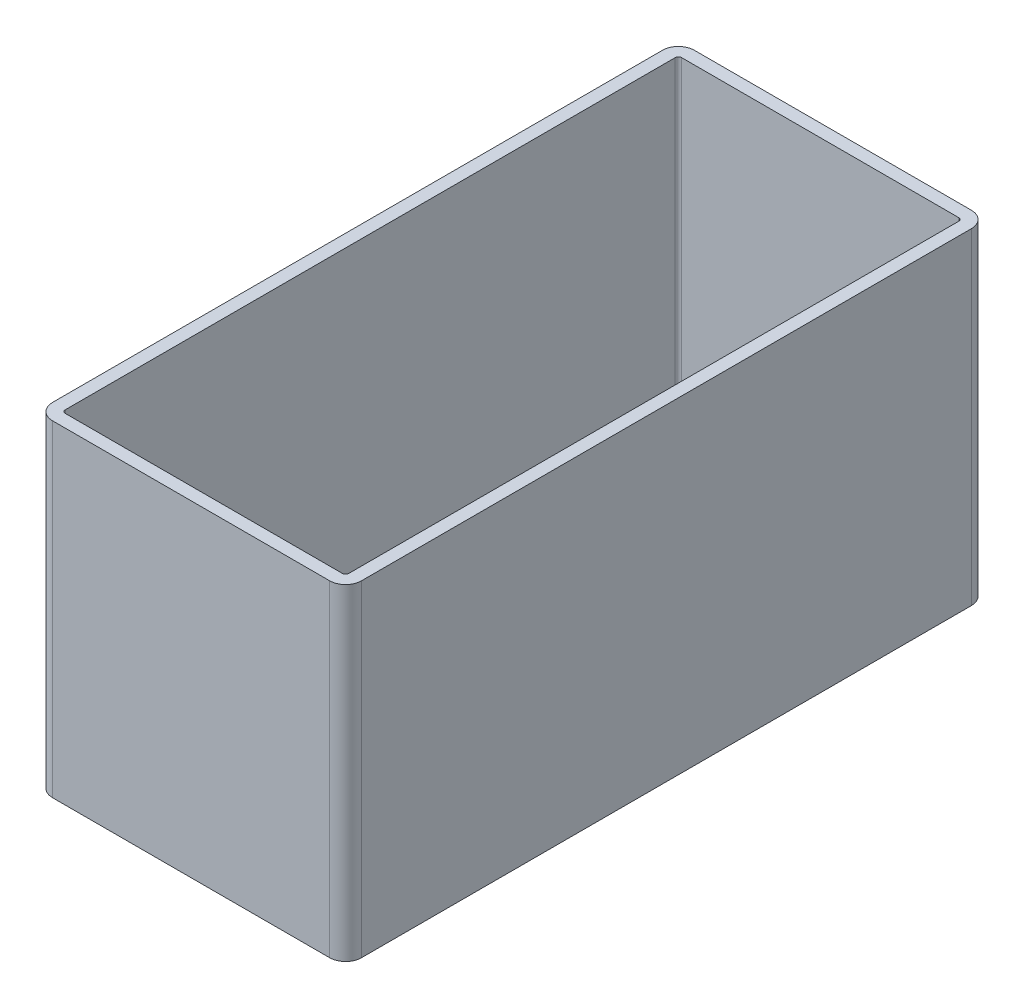
from build123d import *

# Parameters (mm, degrees)
BASES_W            = 19.4
BASES_H            = 40.3
BASE_DEPTH         = 10.25
BASE_F_R           = 1
CUT_EXTRUDE3_DEPTH = 31.337476823


with BuildPart() as part:
    # BaseS → BASE (new, symmetric)
    with BuildSketch(Plane(origin=(0, 0, 0), x_dir=(1, 0, 0), z_dir=(0, 1, 0))):
        Rectangle(BASES_W, BASES_H)
    extrude(amount=BASE_DEPTH, both=True)

    # BASE F
    base_f_edges = [part.edges().sort_by_distance(p)[0] for p in [
        (9.7, 0, 20.15),
        (-9.7, 0, 20.15),
        (-9.7, 0, -20.15),
        (9.7, 0, -20.15),
    ]]
    fillet(base_f_edges, radius=BASE_F_R)

    # PocketS → Cut-Extrude3 (cut, through all)
    with BuildSketch(Plane(origin=(0, 10.25, 0), x_dir=(1, 0, 0), z_dir=(0, 1, 0))):
        with BuildLine():
            Line((8.7, 19.35), (-8.7, 19.35))
            ThreePointArc((-8.7, 19.35), (-8.841421356, 19.291421356), (-8.9, 19.15))
            Line((-8.9, 19.15), (-8.9, -19.15))
            ThreePointArc((-8.9, -19.15), (-8.841421356, -19.291421356), (-8.7, -19.35))
            Line((-8.7, -19.35), (8.7, -19.35))
            ThreePointArc((8.7, -19.35), (8.841421356, -19.291421356), (8.9, -19.15))
            Line((8.9, -19.15), (8.9, 19.15))
            ThreePointArc((8.9, 19.15), (8.841421356, 19.291421356), (8.7, 19.35))
        make_face()
    extrude(amount=-CUT_EXTRUDE3_DEPTH, mode=Mode.SUBTRACT)


solid = part.part
